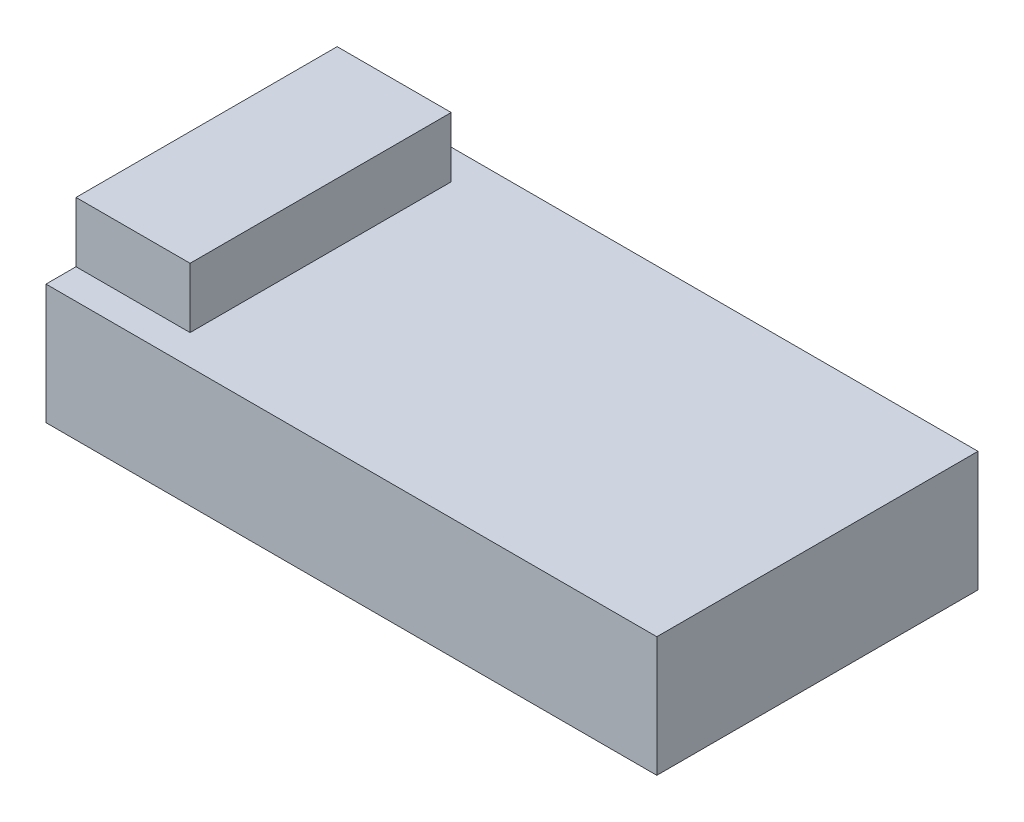
from build123d import *

# Parameters (mm, degrees)
SKETCH1_W           = 40.7
SKETCH1_H           = 21.4
BOSS_EXTRUDE1_DEPTH = 8
SKETCH2_W           = 7.6
SKETCH2_H           = 17.4
BOSS_EXTRUDE2_DEPTH = 4


with BuildPart() as part:
    # Sketch1 → Boss-Extrude1 (new body)
    with BuildSketch(Plane(origin=(0, 0, 0), x_dir=(1, 0, 0), z_dir=(0, 1, 0))):
        Rectangle(SKETCH1_W, SKETCH1_H)
    extrude(amount=BOSS_EXTRUDE1_DEPTH)

    # Sketch2 → Boss-Extrude2 (add)
    with BuildSketch(Plane(origin=(0, 8, 0), x_dir=(1, 0, 0), z_dir=(0, 1, 0))):
        with Locations((-16.55, 0)):
            Rectangle(SKETCH2_W, SKETCH2_H)
    extrude(amount=BOSS_EXTRUDE2_DEPTH)


solid = part.part
